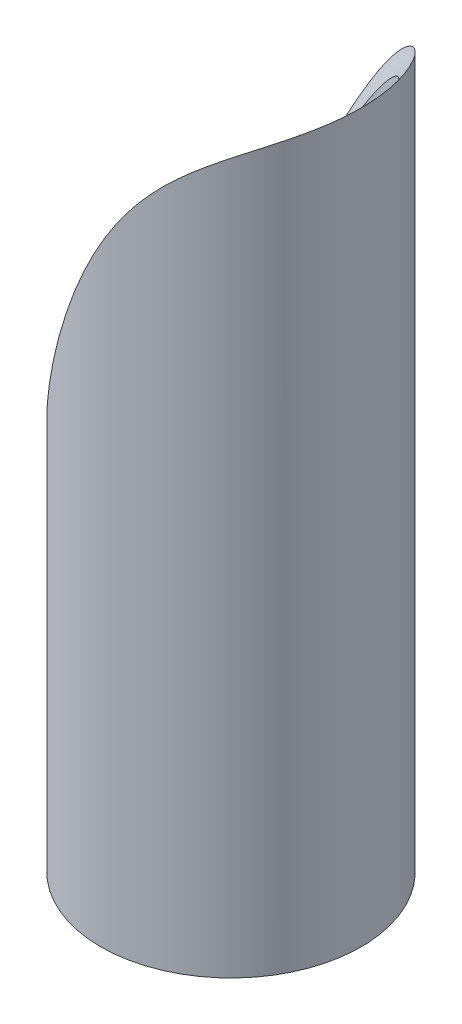
from build123d import *

# Parameters (mm, degrees)
SKETCH1_R           = 11.25
SKETCH1_R_2         = 10.25
BOSS_EXTRUDE1_DEPTH = 75
SKETCH3_R           = 15.875


with BuildPart() as part:
    # Sketch1 → Boss-Extrude1 (new body)
    with BuildSketch(Plane(origin=(0, 0, 0), x_dir=(1, 0, 0), z_dir=(0, 1, 0))):
        with Locations(Location((0, 0, 0), (0, 0, 270))):
            Circle(SKETCH1_R)
        with Locations(Location((0, 0, 0), (0, 0, 270))):
            Circle(SKETCH1_R_2, mode=Mode.SUBTRACT)
    extrude(amount=BOSS_EXTRUDE1_DEPTH)

    # Cut-Sweep1: sweep along a path in Sketch2
    with BuildLine(Plane.XY) as cut_sweep1_path:
        Line((-37.729061511, 9.651348541), (15.573851413, 101.974701916))
    # Sketch3 → Cut-Sweep1 (sweep, cut)
    with BuildSketch(Plane(origin=(15.573851413, 101.974701916, 0), x_dir=(0.8660254037844365, -0.5000000000000039, 0), z_dir=(0.5000000000000038, 0.8660254037844364, 0))):
        Circle(SKETCH3_R)
    sweep(path=cut_sweep1_path.line, mode=Mode.SUBTRACT)


solid = part.part
